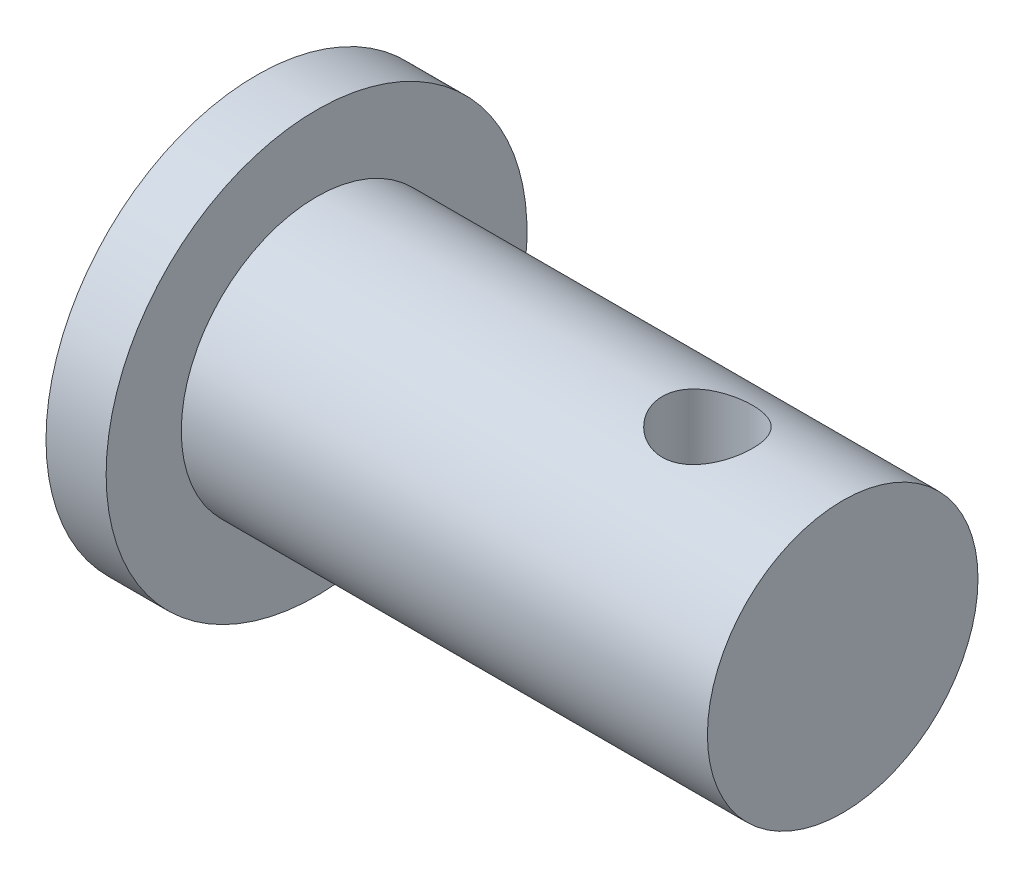
from build123d import *

# Parameters (mm, degrees)
SKETCH1_R               = 4.5
BOSS_EXTRUDE1_DEPTH     = 19.5
SKETCH2_R               = 7
BOSS_EXTRUDE2_DEPTH     = 2
CUT_EXTRUDE1_DEPTH      = 22.868927729
CUT_EXTRUDE1_DEPTH_BACK = 22.868927729
SKETCH3_R               = 1.5


with BuildPart() as part:
    # Sketch1 → Boss-Extrude1 (new body)
    with BuildSketch(Plane(origin=(0, 0, 0), x_dir=(0, 0, -1), z_dir=(1, 0, 0))):
        Circle(SKETCH1_R)
    extrude(amount=BOSS_EXTRUDE1_DEPTH)

    # Sketch2 → Boss-Extrude2 (add)
    with BuildSketch(Plane.ZY):
        Circle(SKETCH2_R)
    extrude(amount=-BOSS_EXTRUDE2_DEPTH)

    # Sketch3 → Cut-Extrude1 (cut, two sides: drawn at the far end of the back side and taken through both)
    with BuildSketch(Plane(origin=(0, 0, 0), x_dir=(1, 0, 0), z_dir=(0, 1, 0)).offset(-CUT_EXTRUDE1_DEPTH_BACK)):
        with Locations(Location((15, 0, 0), (0, 0, 270))):
            Circle(SKETCH3_R)
    extrude(amount=CUT_EXTRUDE1_DEPTH + CUT_EXTRUDE1_DEPTH_BACK, mode=Mode.SUBTRACT)


solid = part.part
